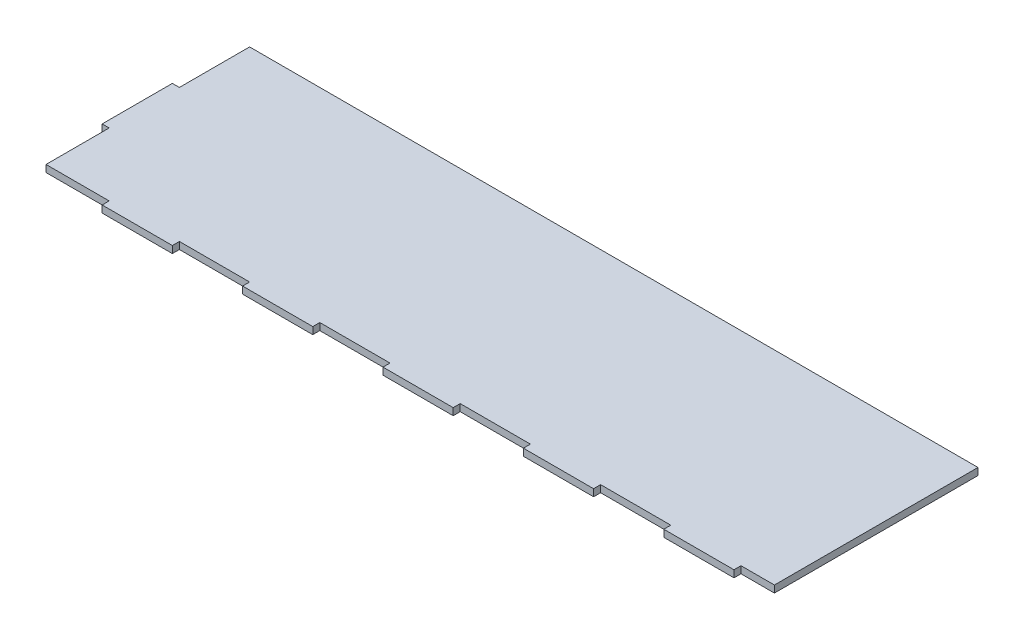
from build123d import *

# Parameters (mm, degrees)
SKETCH1_W           = 630
SKETCH1_H           = 90
BOSS_EXTRUDE1_DEPTH = 3
SKETCH3_W           = 30
SKETCH3_H           = 3
CUT_EXTRUDE1_DEPTH  = 3
LPATTERN1_COUNT     = 10
LPATTERN1_PITCH     = 60
LPATTERN1_COL_COUNT = 2
LPATTERN1_COL_PITCH = 60
SKETCH7_W           = 3
SKETCH7_H           = 30
CUT_EXTRUDE3_DEPTH  = 3
SKETCH13_W          = 3
SKETCH13_H          = 27
CUT_EXTRUDE4_DEPTH  = 10


with BuildPart() as part:
    # Sketch1 → Boss-Extrude1 (new body)
    with BuildSketch(Plane(origin=(0, 0, 0), x_dir=(1, 0, 0), z_dir=(0, 1, 0))):
        Rectangle(SKETCH1_W, SKETCH1_H)
    extrude(amount=BOSS_EXTRUDE1_DEPTH)

    # Sketch3 → Cut-Extrude1 (cut)
    with BuildSketch(Plane(origin=(0, 3, 0), x_dir=(1, 0, 0), z_dir=(0, 1, 0))):
        with Locations((-240, -43.5)):
            Rectangle(SKETCH3_W, SKETCH3_H)
    cut_extrude1 = extrude(amount=-CUT_EXTRUDE1_DEPTH, mode=Mode.SUBTRACT)

    # LPattern1: Cut-Extrude1 ×10
    with Locations(*[(i * LPATTERN1_PITCH, 0, 0) for i in range(1, LPATTERN1_COUNT)]):
        add(cut_extrude1, mode=Mode.SUBTRACT)

    # LPattern1 col: Cut-Extrude1 ×2
    with Locations(*[(-i * LPATTERN1_COL_PITCH, 0, 0) for i in range(1, LPATTERN1_COL_COUNT)]):
        add(cut_extrude1, mode=Mode.SUBTRACT)

    # Sketch7 → Cut-Extrude3 (cut)
    with BuildSketch(Plane(origin=(0, 3, 0), x_dir=(1, 0, 0), z_dir=(0, 1, 0))):
        with Locations((-313.5, 30)):
            Rectangle(SKETCH7_W, SKETCH7_H)
    extrude(amount=-CUT_EXTRUDE3_DEPTH, mode=Mode.SUBTRACT)

    # Sketch13 → Cut-Extrude4 (cut)
    with BuildSketch(Plane(origin=(0, 3, 0), x_dir=(1, 0, 0), z_dir=(0, 1, 0))):
        with Locations((-313.5, -28.5)):
            Rectangle(SKETCH13_W, SKETCH13_H)
    extrude(amount=-CUT_EXTRUDE4_DEPTH, mode=Mode.SUBTRACT)

    # SurfaceCut1
    split(bisect_by=Plane(origin=(-0.725, 0, 0), x_dir=(0, 0, -1), z_dir=(1, 0, 0)), keep=Keep.BOTTOM)


solid = part.part
